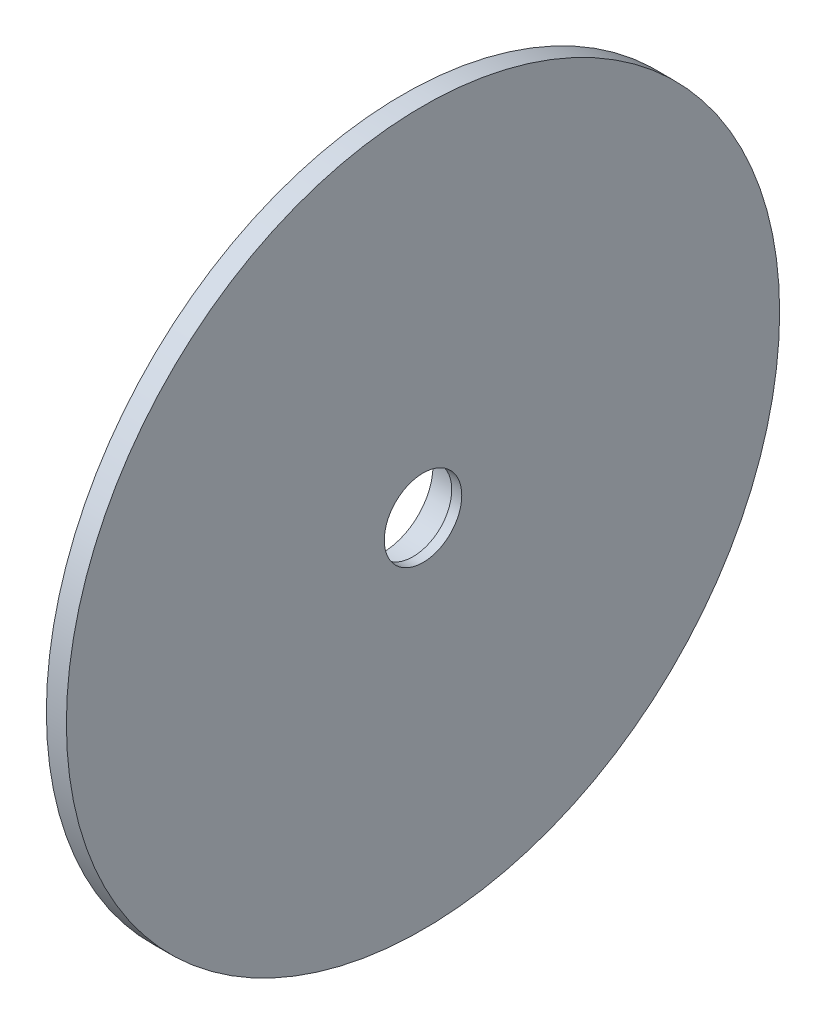
from build123d import *


with BuildPart() as part:
    # Sketch1 → Revolve1 (revolve)
    with BuildSketch(Plane.XY, mode=Mode.PRIVATE) as revolve1_sk:
        Polygon((-3.2523385, 15.480769231), (-7.2523385, 15.480769231), (-7.2523385, 20), (-19.2523385, 20), (-19.2523385, 92.048289024), (-26.2523385, 92.048289024), (-26.2523385, 100), (-32.268209286, 100), (-32.268209286, 105), (-11.2523385, 105), (-11.2523385, 142.480769231), (-3.2523385, 142.480769231), (-3.2523385, 105), align=None)
    revolve(revolve1_sk.sketch.rotate(Axis((0, 0, 0), (-1, 0, 0)), 90), axis=Axis((0, 0, 0), (-1, 0, 0)))


solid = part.part
